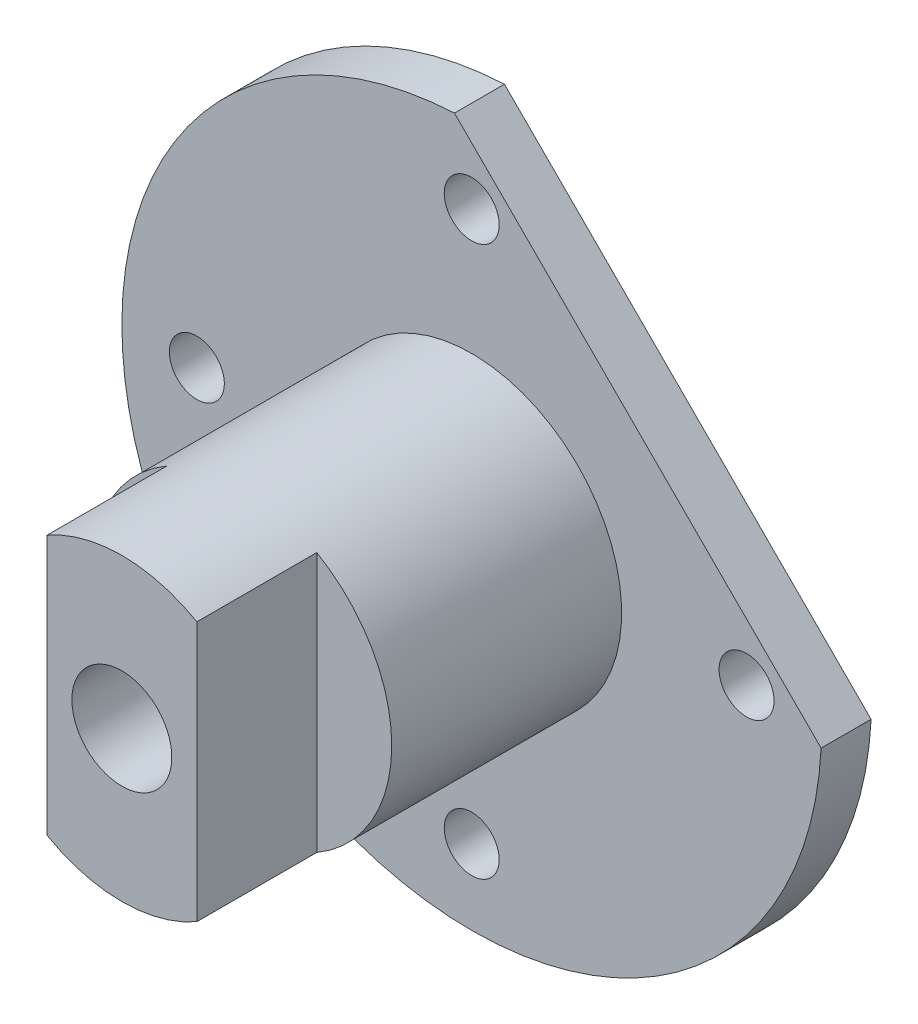
from build123d import *

# Parameters (mm, degrees)
SKETCH1_R            = 15
BOSS_EXTRUDE1_DEPTH  = 40
SKETCH2_R            = 35
BOSS_EXTRUDE2_DEPTH  = 5
SKETCH3_R            = 5
CUT_EXTRUDE1_DEPTH   = 64.639610307
CUT_EXTRUDE2_DEPTH   = 10
SKETCH5_W            = 7.5
SKETCH5_H            = 12
CUT_EXTRUDE3_DEPTH   = 64.639610307
M5_CLEARANCE_HOLE1_D = 5.5
CUT_EXTRUDE4_DEPTH   = 64.639610307


with BuildPart() as part:
    # Sketch1 → Boss-Extrude1 (new body)
    with BuildSketch(Plane.XY):
        Circle(SKETCH1_R)
    extrude(amount=BOSS_EXTRUDE1_DEPTH)

    # Sketch2 → Boss-Extrude2 (add)
    with BuildSketch(Plane(origin=(0, 0, 0), x_dir=(-1, 0, 0), z_dir=(0, 0, -1))):
        Circle(SKETCH2_R)
    extrude(amount=-BOSS_EXTRUDE2_DEPTH)

    # Sketch3 → Cut-Extrude1 (cut, through all)
    with BuildSketch(Plane(origin=(0, 0, 0), x_dir=(-1, 0, 0), z_dir=(0, 0, -1))):
        Circle(SKETCH3_R)
    extrude(amount=-CUT_EXTRUDE1_DEPTH, mode=Mode.SUBTRACT)

    # Sketch4 → Cut-Extrude2 (cut)
    with BuildSketch(Plane(origin=(0, 0, 0), x_dir=(-1, 0, 0), z_dir=(0, 0, -1))):
        Polygon((8, 0), (4, 6.92820323), (-4, 6.92820323), (-8, 0), (-4, -6.92820323), (4, -6.92820323), align=None)
    extrude(amount=-CUT_EXTRUDE2_DEPTH, mode=Mode.SUBTRACT)

    # Sketch5 → Cut-Extrude3 (cut, symmetric)
    with BuildSketch(Plane(origin=(0, 0, 0), x_dir=(1, 0, 0), z_dir=(0, 1, 0))):
        with Locations((11.25, -34)):
            Rectangle(SKETCH5_W, SKETCH5_H)
    cut_extrude3 = extrude(amount=CUT_EXTRUDE3_DEPTH, both=True, mode=Mode.SUBTRACT)

    # Mirror1: Cut-Extrude3 across plane
    add(cut_extrude3.mirror(Plane(origin=(0, 0, 0), x_dir=(0, 0, 1), z_dir=(1, 0, 0))), mode=Mode.SUBTRACT)

    # M5 Clearance Hole1 (through all)
    with Locations(Plane(origin=(0, 0, 0), x_dir=(-1, 0, 0), z_dir=(0, 0, -1))):
        with Locations((0, 27.5), (-27.5, 0), (27.5, 0), (0, -27.5)):
            Hole(M5_CLEARANCE_HOLE1_D / 2)

    # Sketch8 → Cut-Extrude4 (cut, through all)
    with BuildSketch(Plane(origin=(0, 0, 0), x_dir=(-1, 0, 0), z_dir=(0, 0, -1))):
        with BuildLine():
            Line((-34.957538249, -1.723519533), (1.723519533, 34.957538249))
            ThreePointArc((1.723519533, 34.957538249), (-24.748737342, 24.748737342), (-34.957538249, -1.723519533))
        make_face()
    extrude(amount=-CUT_EXTRUDE4_DEPTH, mode=Mode.SUBTRACT)


solid = part.part
